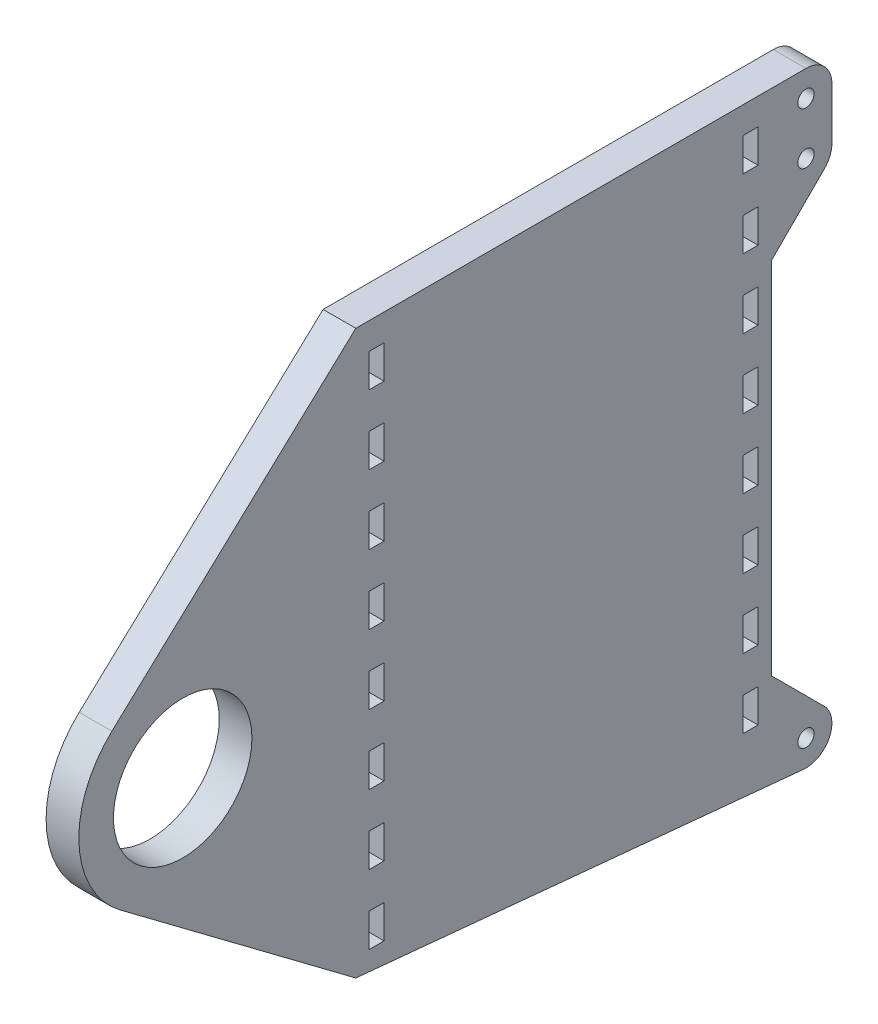
from build123d import *

# Parameters (mm, degrees)
SKETCH4_R           = 1.5
SKETCH4_R_2         = 12.7
BOSS_EXTRUDE1_DEPTH = 3
SKETCH5_W           = 2.75
SKETCH5_H           = 6.096
LOWERSLOT_DEPTH     = 115.203880872
SKETCH5_3_W         = 2.75
SKETCH5_3_H         = 6.096
UPPERSLOT_DEPTH     = 115.203880872
LOWERSLOTS_COUNT    = 8
LOWERSLOTS_PITCH    = 12.7
UPPERSLOTS_COUNT    = 8
UPPERSLOTS_PITCH    = 12.7


with BuildPart() as part:
    # Sketch4 → Boss-Extrude1 (new, symmetric)
    with BuildSketch(Plane(origin=(0, 0, 0), x_dir=(0, 0, -1), z_dir=(1, 0, 0))):
        with BuildLine():
            ThreePointArc((47.817596045, 22.032403955), (48.849976274, 23.577470153), (49.2125, 25.4))
            Line((49.2125, 25.4), (49.2125, 34.925))
            ThreePointArc((49.2125, 34.925), (47.817596045, 38.292596045), (44.45, 39.6875))
            Line((44.45, 39.6875), (-38.1, 39.6875))
            Line((-38.1, 39.6875), (-82.826645448, -1.928345458))
            ThreePointArc((-82.826645448, -1.928345458), (-88.873309027, -16.88307423), (-81.28, -31.115))
            Line((-81.28, -31.115), (-38.1, -63.5))
            Line((-38.1, -63.5), (43.992912904, -71.415514491))
            ThreePointArc((43.992912904, -71.415514491), (48.757334408, -68.706816071), (47.817596045, -63.307403955))
            Line((47.817596045, -63.307403955), (38.1, -53.589807909))
            Line((38.1, -53.589807909), (38.1, 12.314807909))
            Line((38.1, 12.314807909), (47.817596045, 22.032403955))
        make_face()
        with Locations((44.45, -66.675)):
            Circle(SKETCH4_R, mode=Mode.SUBTRACT)
        with Locations((44.45, 25.4)):
            Circle(SKETCH4_R, mode=Mode.SUBTRACT)
        with Locations((44.45, 34.925)):
            Circle(SKETCH4_R, mode=Mode.SUBTRACT)
        with Locations((-69.85, -15.875)):
            Circle(SKETCH4_R_2, mode=Mode.SUBTRACT)
    extrude(amount=BOSS_EXTRUDE1_DEPTH, both=True)

    # Sketch5 → LowerSlot (cut, symmetric)
    with BuildSketch(Plane(origin=(3, 0, 0), x_dir=(0, 0, -1), z_dir=(1, 0, 0))):
        with Locations((34.29, -57.15)):
            Rectangle(SKETCH5_W, SKETCH5_H)
    lowerslot = extrude(amount=LOWERSLOT_DEPTH, both=True, mode=Mode.SUBTRACT)

    # Sketch5<3> → UpperSlot (cut, symmetric)
    with BuildSketch(Plane(origin=(3, 0, 0), x_dir=(0, 0, -1), z_dir=(1, 0, 0))):
        with Locations((-34.29, -57.15)):
            Rectangle(SKETCH5_3_W, SKETCH5_3_H)
    upperslot = extrude(amount=UPPERSLOT_DEPTH, both=True, mode=Mode.SUBTRACT)

    # LowerSlots: LowerSlot ×8
    with Locations(*[(0, i * LOWERSLOTS_PITCH, 0) for i in range(1, LOWERSLOTS_COUNT)]):
        add(lowerslot, mode=Mode.SUBTRACT)

    # UpperSlots: UpperSlot ×8
    with Locations(*[(0, i * UPPERSLOTS_PITCH, 0) for i in range(1, UPPERSLOTS_COUNT)]):
        add(upperslot, mode=Mode.SUBTRACT)


solid = part.part
